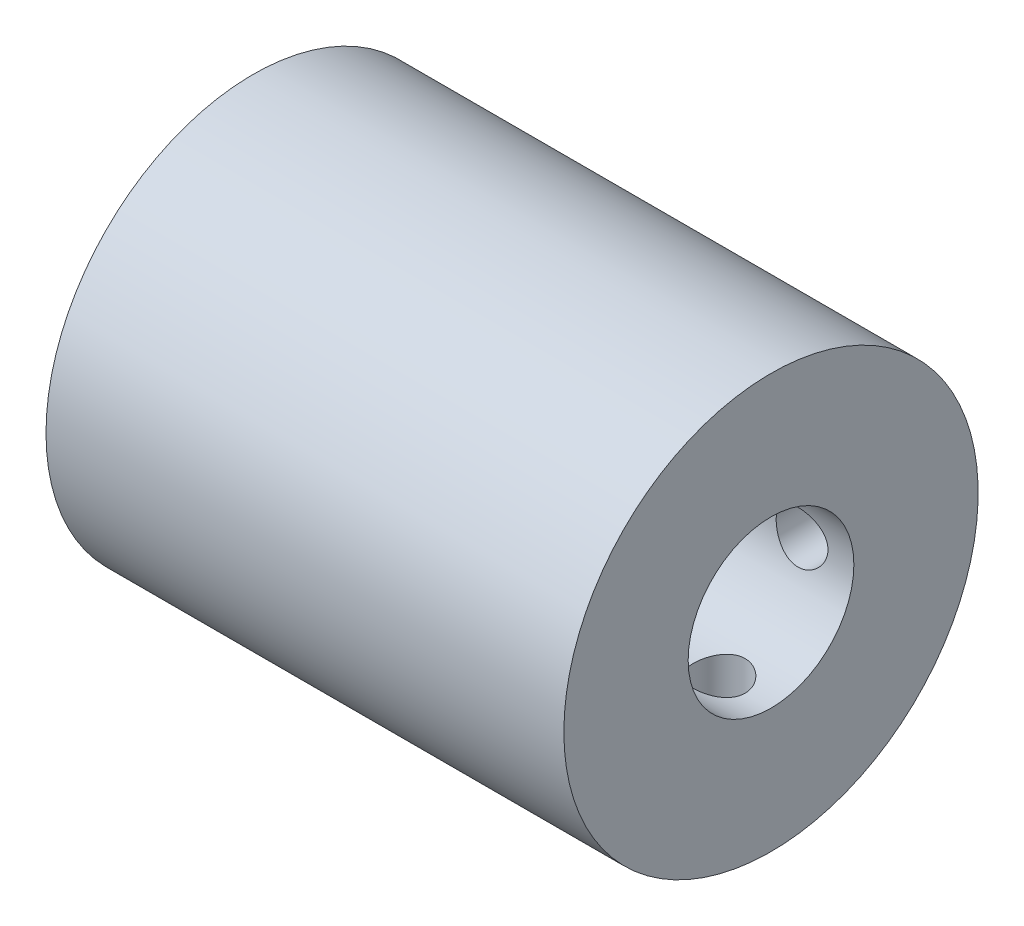
from build123d import *

# Parameters (mm, degrees)
SKETCH2_R          = 1.25
CUT_EXTRUDE1_DEPTH = 10
CIRPATTERN1_COUNT  = 2
CIRPATTERN1_ANGLE  = 270


with BuildPart() as part:
    # Sketch1 → Revolve1 (revolve)
    with BuildSketch(Plane.XY, mode=Mode.PRIVATE) as revolve1_sk:
        Polygon((0, 0), (25, 0), (25, 6), (12.5, 6), (12.5, 7.5), (0, 7.5), align=None)
    revolve(revolve1_sk.sketch.rotate(Axis((0, 10, 0), (1, 0, 0)), 270), axis=Axis((0, 10, 0), (1, 0, 0)))

    # Sketch2 → Cut-Extrude1 (cut)
    with BuildSketch(Plane.XY):
        with Locations((22.5, 10)):
            Circle(SKETCH2_R)
        with Locations((2.5, 10)):
            Circle(SKETCH2_R)
    cut_extrude1 = extrude(amount=-CUT_EXTRUDE1_DEPTH, mode=Mode.SUBTRACT)

    # CirPattern1: Cut-Extrude1 ×2 about axis
    cirpattern1_axis = Axis((0, 10, 0), (1, 0, 0))
    for i in range(1, CIRPATTERN1_COUNT):
        add(cut_extrude1.rotate(cirpattern1_axis, i * CIRPATTERN1_ANGLE / (CIRPATTERN1_COUNT - 1)), mode=Mode.SUBTRACT)


solid = part.part
